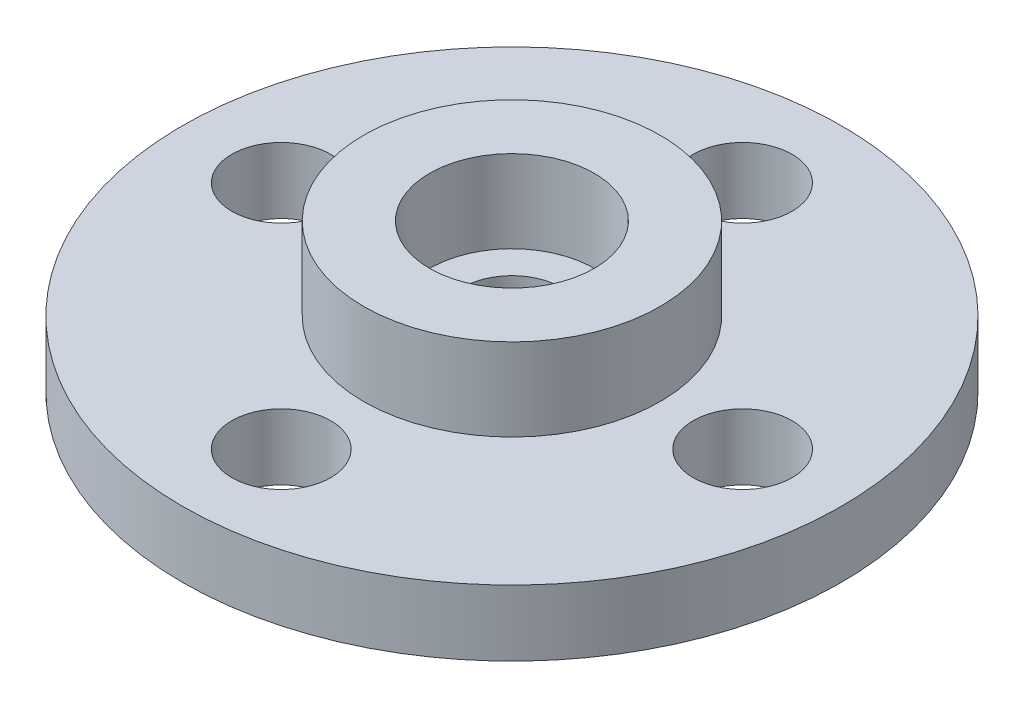
from build123d import *

# Parameters (mm, degrees)
SKETCH_1_R          = 10
EXTRUDE_1_DEPTH     = 2
SKETCH_2_R          = 1.5
CUT_EXTRUDE_1_DEPTH = 2
SKETCH_3_R          = 4.5
SKETCH_3_R_2        = 2.5
EXTRUDE_2_DEPTH     = 2.5


with BuildPart() as part:
    # 草图1 → 凸台-拉伸1 (new body)
    with BuildSketch(Plane(origin=(0, 0, 0), x_dir=(1, 0, 0), z_dir=(0, 1, 0))):
        with Locations(Location((0, 0, 0), (0, 0, 270))):
            Circle(SKETCH_1_R)
    extrude(amount=EXTRUDE_1_DEPTH)

    # 草图2 → 切除-拉伸1 (cut)
    with BuildSketch(Plane(origin=(0, 2, 0), x_dir=(1, 0, 0), z_dir=(0, 1, 0))):
        with Locations(Location((0, 0, 0), (0, 0, 270))):
            Circle(SKETCH_2_R)
        with Locations(Location((0, 7, 0), (0, 0, 270))):
            Circle(SKETCH_2_R)
        with Locations(Location((7, 0, 0), (0, 0, 270))):
            Circle(SKETCH_2_R)
        with Locations(Location((0, -7, 0), (0, 0, 270))):
            Circle(SKETCH_2_R)
        with Locations(Location((-7, 0, 0), (0, 0, 270))):
            Circle(SKETCH_2_R)
    extrude(amount=-CUT_EXTRUDE_1_DEPTH, mode=Mode.SUBTRACT)

    # 草图3 → 凸台-拉伸2 (add)
    with BuildSketch(Plane(origin=(0, 2, 0), x_dir=(1, 0, 0), z_dir=(0, 1, 0))):
        with Locations(Location((0, 0, 0), (0, 0, 270))):
            Circle(SKETCH_3_R)
        with Locations(Location((0, 0, 0), (0, 0, 270))):
            Circle(SKETCH_3_R_2, mode=Mode.SUBTRACT)
    extrude(amount=EXTRUDE_2_DEPTH)


solid = part.part
